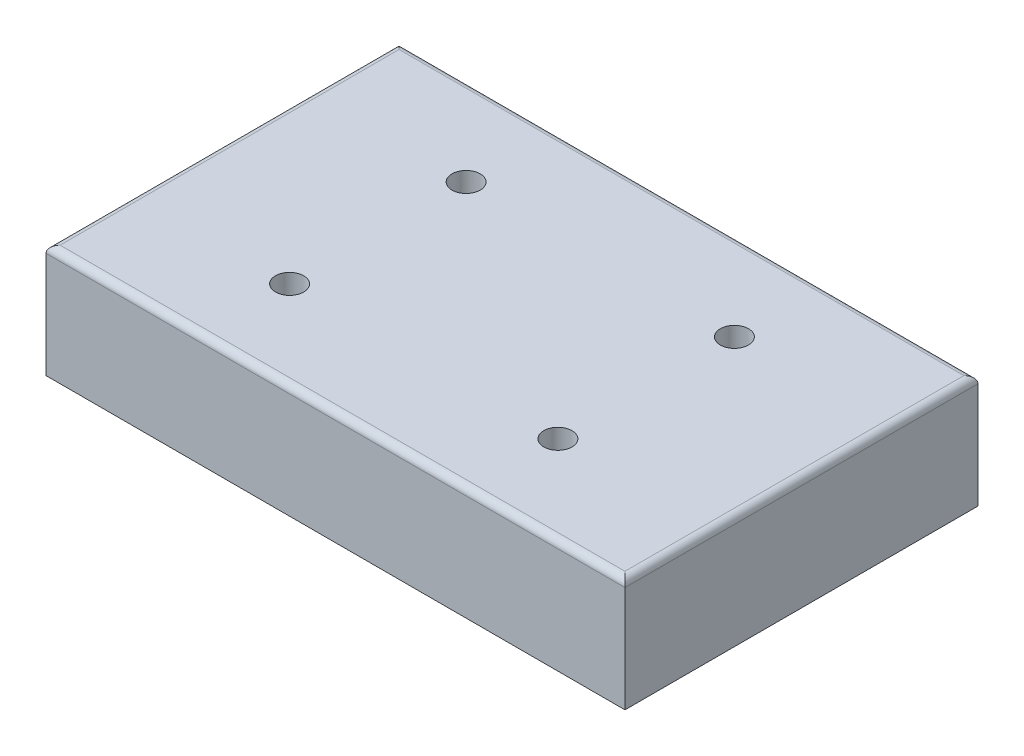
from build123d import *

# Parameters (mm, degrees)
SKETCH1_W                    = 82
SKETCH1_H                    = 50
BOSS_EXTRUDE1_DEPTH          = 16
FILLET1_R                    = 1
F_4_0_4_DIAMETER_HOLE3_D     = 4
F_4_0_4_DIAMETER_HOLE3_DEPTH = 6.798278762
F_4_0_4_DIAMETER_HOLE3_TIP   = 1.201721238


with BuildPart() as part:
    # Sketch1 → Boss-Extrude1 (new body)
    with BuildSketch(Plane(origin=(0, 0, 0), x_dir=(1, 0, 0), z_dir=(0, 1, 0))):
        Rectangle(SKETCH1_W, SKETCH1_H)
    extrude(amount=BOSS_EXTRUDE1_DEPTH)

    # Fillet1
    fillet1_edges = [part.edges().sort_by_distance(p)[0] for p in [
        (-41, 16, 0),
        (0, 16, 25),
        (41, 16, 0),
        (0, 16, -25),
    ]]
    fillet(fillet1_edges, radius=FILLET1_R)

    # Ø4.0 (4) Diameter Hole3
    with Locations(Plane(origin=(0, 16, 0), x_dir=(1, 0, 0), z_dir=(0, 1, 0))):
        with Locations((-19, 12.5), (19, 12.5), (19, -12.5), (-19, -12.5)):
            Hole(F_4_0_4_DIAMETER_HOLE3_D / 2, depth=F_4_0_4_DIAMETER_HOLE3_DEPTH)
            with Locations((0, 0, -(F_4_0_4_DIAMETER_HOLE3_DEPTH + F_4_0_4_DIAMETER_HOLE3_TIP / 2))):  # 118° drill point
                Cone(0, F_4_0_4_DIAMETER_HOLE3_D / 2, F_4_0_4_DIAMETER_HOLE3_TIP, mode=Mode.SUBTRACT)


solid = part.part
